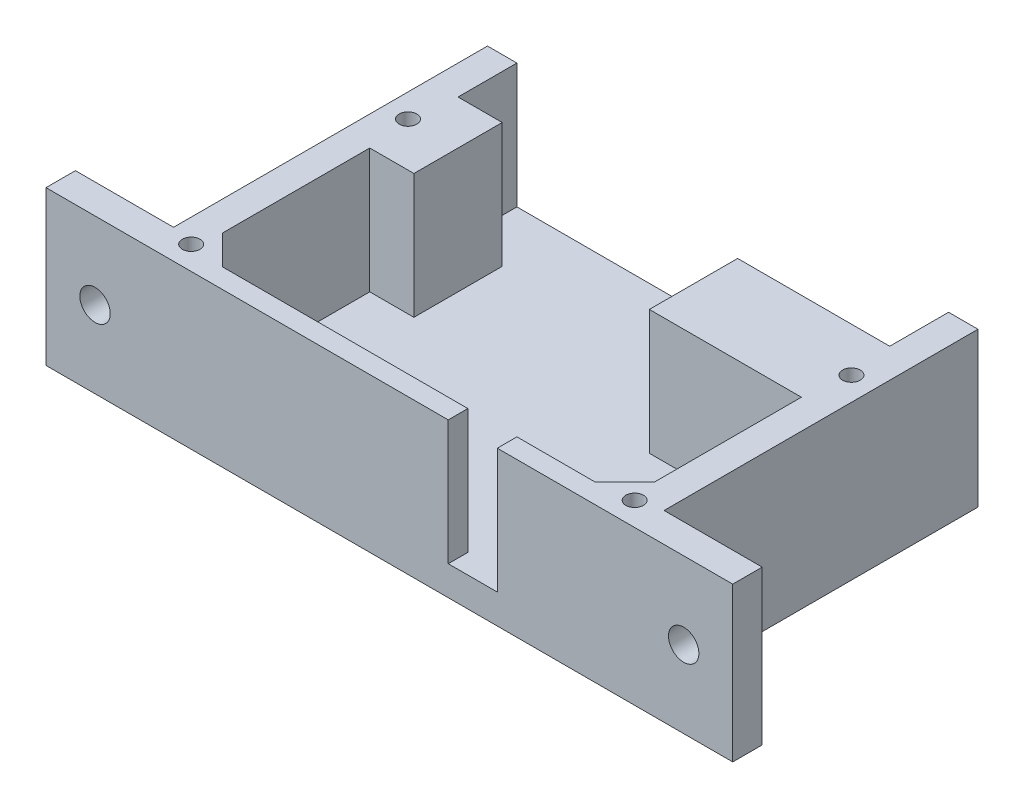
from build123d import *

# Parameters (mm, degrees)
SKETCH1_W           = 50
SKETCH1_H           = 35
BOSS_EXTRUDE1_DEPTH = 3
BOSS_EXTRUDE2_DEPTH = 12.7
CHAMFER1_SIZE       = 3
SKETCH3_R           = 0.9
CUT_EXTRUDE1_DEPTH  = 8
SKETCH4_R           = 0.9
CUT_EXTRUDE2_DEPTH  = 8
SKETCH5_R           = 0.9
CUT_EXTRUDE3_DEPTH  = 8
SKETCH6_W           = 3
SKETCH6_H           = 15.7
BOSS_EXTRUDE3_DEPTH = 10
SKETCH7_W           = 3
SKETCH7_H           = 15.7
BOSS_EXTRUDE4_DEPTH = 10
SKETCH8_R           = 1.55
CUT_EXTRUDE4_DEPTH  = 10


with BuildPart() as part:
    # Sketch1 → Boss-Extrude1 (new body)
    with BuildSketch(Plane(origin=(0, 0, 0), x_dir=(1, 0, 0), z_dir=(0, 1, 0))):
        Rectangle(SKETCH1_W, SKETCH1_H)
    extrude(amount=BOSS_EXTRUDE1_DEPTH)

    # Sketch2 → Boss-Extrude2 (add)
    with BuildSketch(Plane(origin=(0, 3, 0), x_dir=(1, 0, 0), z_dir=(0, 1, 0))):
        Polygon((25, 17.5), (22, 17.5), (22, 11.5), (6.5, 11.5), (6.5, 2.5), (22, 2.5), (22, -15.5), (11, -15.5), (11, -17.5), (22, -17.5), (25, -17.5), (25, 2.5), (25, 11.5), align=None)
        Polygon((-17.5, 11.5), (-22, 11.5), (-22, 17.5), (-25, 17.5), (-25, 11.5), (-25, 2.5), (-25, -17.5), (-22, -17.5), (6, -17.5), (6, -15.5), (-22, -15.5), (-22, 2.5), (-17.5, 2.5), align=None)
    extrude(amount=BOSS_EXTRUDE2_DEPTH)

    # Chamfer1
    chamfer1_edges = [part.edges().sort_by_distance(p)[0] for p in [
        (22, 9.35, 15.5),
        (-22, 9.35, 15.5),
    ]]
    chamfer(chamfer1_edges, length=CHAMFER1_SIZE)

    # Sketch3 → Cut-Extrude1 (cut)
    with BuildSketch(Plane(origin=(0, 15.7, 0), x_dir=(1, 0, 0), z_dir=(0, 1, 0))):
        with Locations(Location((-22.6, -15.1, 0), (0, 0, 270))):
            Circle(SKETCH3_R)
        with Locations(Location((22.6, -15.1, 0), (0, 0, 270))):
            Circle(SKETCH3_R)
        with Locations(Location((22.6, 7, 0), (0, 0, 270))):
            Circle(SKETCH3_R)
    extrude(amount=-CUT_EXTRUDE1_DEPTH, mode=Mode.SUBTRACT)

    # Sketch4 → Cut-Extrude2 (cut)
    with BuildSketch(Plane(origin=(0, 15.7, 0), x_dir=(1, 0, 0), z_dir=(0, 1, 0))):
        with Locations(Location((-22.6, 7, 0), (0, 0, 270))):
            Circle(SKETCH4_R)
    extrude(amount=-CUT_EXTRUDE2_DEPTH, mode=Mode.SUBTRACT)

    # Sketch5 → Cut-Extrude3 (cut)
    with BuildSketch(Plane(origin=(0, 0, -11.5), x_dir=(-1, 0, 0), z_dir=(0, 0, -1))):
        with Locations((20, 9.35)):
            Circle(SKETCH5_R)
        with Locations((-9, 9.35)):
            Circle(SKETCH5_R)
    extrude(amount=-CUT_EXTRUDE3_DEPTH, mode=Mode.SUBTRACT)

    # Sketch6 → Boss-Extrude3 (add)
    with BuildSketch(Plane.ZY.offset(25)):
        with Locations((16, 7.85)):
            Rectangle(SKETCH6_W, SKETCH6_H)
    extrude(amount=BOSS_EXTRUDE3_DEPTH)

    # Sketch7 → Boss-Extrude4 (add)
    with BuildSketch(Plane(origin=(25, 0, 0), x_dir=(0, 0, -1), z_dir=(1, 0, 0))):
        with Locations((-16, 7.85)):
            Rectangle(SKETCH7_W, SKETCH7_H)
    extrude(amount=BOSS_EXTRUDE4_DEPTH)

    # Sketch8 → Cut-Extrude4 (cut)
    with BuildSketch(Plane(origin=(0, 0, 14.5), x_dir=(-1, 0, 0), z_dir=(0, 0, -1))):
        with Locations(Location((30, 7.85, 0), (0, 0, 90))):
            Circle(SKETCH8_R)
        with Locations(Location((-30, 7.85, 0), (0, 0, 90))):
            Circle(SKETCH8_R)
    extrude(amount=-CUT_EXTRUDE4_DEPTH, mode=Mode.SUBTRACT)


solid = part.part
